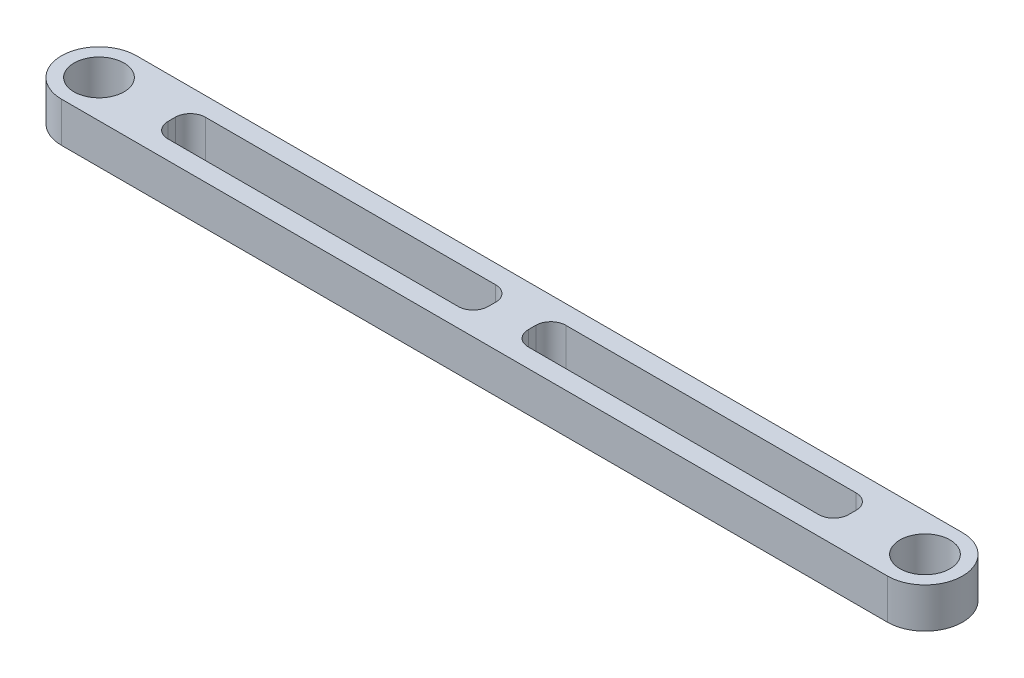
from build123d import *

# Parameters (mm, degrees)
SKETCH_1_W      = 64
SKETCH_1_H      = 7.5
SKETCH_1_R      = 7.5
SKETCH_1_R_2    = 5
EXTRUDE_1_DEPTH = 8
FILLET_1_R      = 3


with BuildPart() as part:
    # 草图1 → 凸台-拉伸1 (new body)
    # profile 1 of 3: a face of its own
    with BuildSketch(Plane(origin=(0, 0, 0), x_dir=(1, 0, 0), z_dir=(0, 1, 0))):
        with BuildLine():
            Line((165, 7.5), (0, 7.5))
            ThreePointArc((0, 7.5), (5.303300859, 5.303300859), (7.5, 0))
            ThreePointArc((7.5, 0), (5.303300859, -5.303300859), (0, -7.5))
            Line((0, -7.5), (165, -7.5))
            ThreePointArc((165, -7.5), (157.5, 0), (165, 7.5))
        make_face()
        with Locations((46.5, 0)):
            Rectangle(SKETCH_1_W, SKETCH_1_H, mode=Mode.SUBTRACT)
        with Locations((118.5, 0)):
            Rectangle(SKETCH_1_W, SKETCH_1_H, mode=Mode.SUBTRACT)
    # profile 2 of 3: a face of its own
    with BuildSketch(Plane(origin=(0, 0, 0), x_dir=(1, 0, 0), z_dir=(0, 1, 0))):
        Circle(SKETCH_1_R)
        with Locations(Location((0, 0, 0), (0, 0, 270))):
            Circle(SKETCH_1_R_2, mode=Mode.SUBTRACT)
    # profile 3 of 3: a face of its own
    with BuildSketch(Plane(origin=(0, 0, 0), x_dir=(1, 0, 0), z_dir=(0, 1, 0))):
        with Locations((165, 0)):
            Circle(SKETCH_1_R)
        with Locations(Location((165, 0, 0), (0, 0, 270))):
            Circle(SKETCH_1_R_2, mode=Mode.SUBTRACT)
    extrude(amount=EXTRUDE_1_DEPTH)

    # 圆角1
    fillet_1_edges = [part.edges().sort_by_distance(p)[0] for p in [
        (86.5, 4, -3.75),
        (86.5, 4, 3.75),
        (150.5, 4, 3.75),
        (150.5, 4, -3.75),
        (14.5, 4, -3.75),
        (14.5, 4, 3.75),
        (78.5, 4, 3.75),
        (78.5, 4, -3.75),
    ]]
    fillet(fillet_1_edges, radius=FILLET_1_R)


solid = part.part
